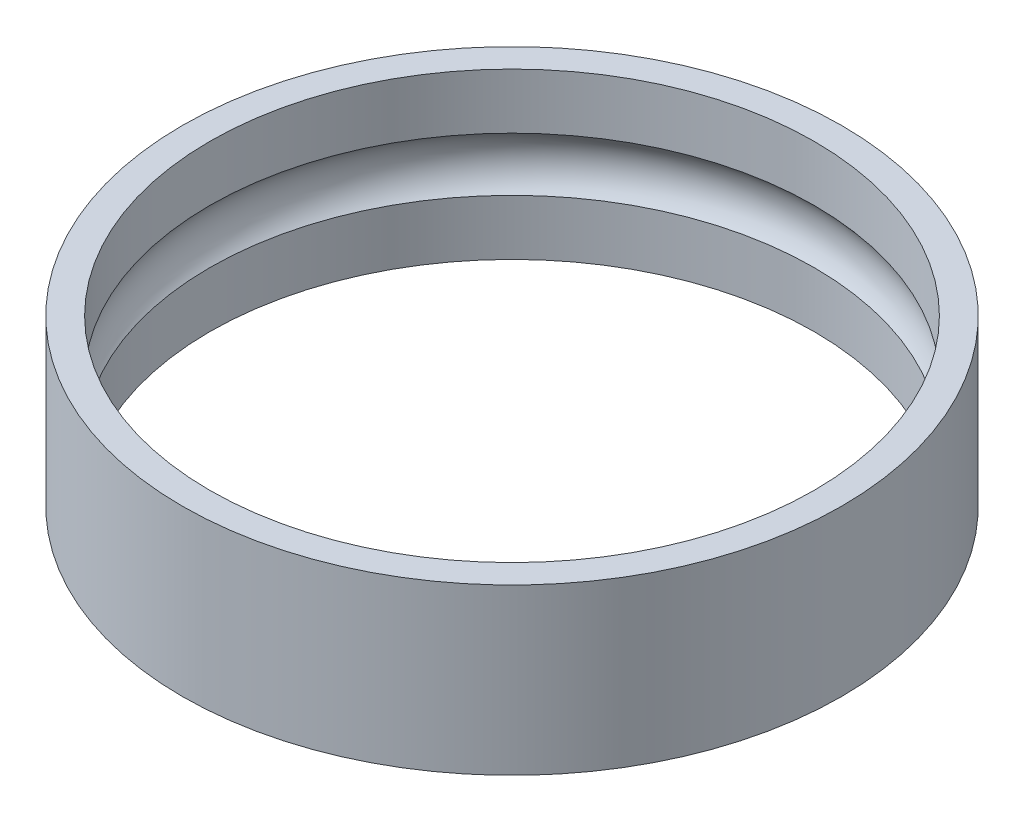
from build123d import *

# Parameters (mm, degrees)
DIAPROFILES_R         = 6
DIAPROFILES_R_2       = 5.5
DIAPROFILE_DEPTH      = 1.5
BEARINGPATHPROFILES_R = 0.7


with BuildPart() as part:
    # DiaProfileS → DiaProfile (new, symmetric)
    with BuildSketch(Plane(origin=(0, 0, 0), x_dir=(1, 0, 0), z_dir=(0, 1, 0))):
        with Locations(Location((0, 0, 0), (0, 0, 270))):
            Circle(DIAPROFILES_R)
        with Locations(Location((0, 0, 0), (0, 0, 270))):
            Circle(DIAPROFILES_R_2, mode=Mode.SUBTRACT)
    extrude(amount=DIAPROFILE_DEPTH, both=True)

    # BearingPathProfileS → BearingPathProfile (revolve, cut)
    with BuildSketch(Plane.XY, mode=Mode.PRIVATE) as bearingpathprofile_sk:
        with Locations((5, 0)):
            Circle(BEARINGPATHPROFILES_R)
    revolve(bearingpathprofile_sk.sketch.rotate(Axis((0, 1.5, 0), (0, -1, 0)), 90), axis=Axis((0, 1.5, 0), (0, -1, 0)), mode=Mode.SUBTRACT)


solid = part.part
